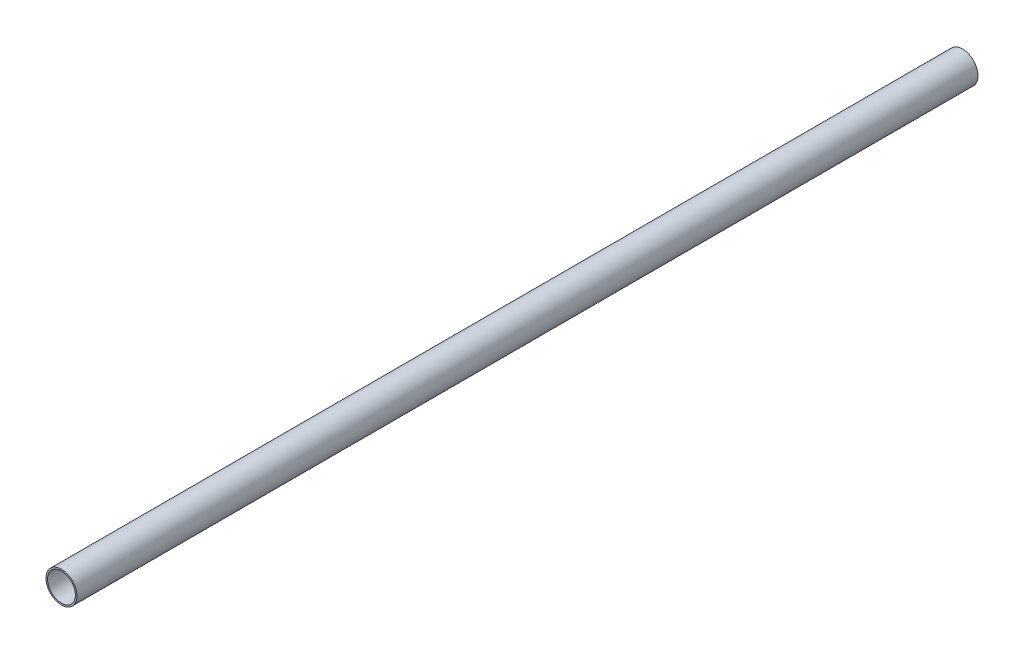
from build123d import *

# Parameters (mm, degrees)
SKETCH1_R = 5
SHELL1_T  = -0.5


with BuildPart() as part:
    # Sweep1: sweep along a path in Sketch2
    with BuildLine(Plane(origin=(0, 0, 0), x_dir=(1, 0, 0), z_dir=(0, 1, 0))) as sweep1_path:
        Line((0, 0), (0, 291))
    # Sketch1 → Sweep1 (sweep)
    with BuildSketch(Plane.XY):
        Circle(SKETCH1_R)
    sweep(path=sweep1_path.line)

    # Shell1
    shell1_openings = [part.faces().sort_by_distance(p)[0] for p in [
        (0, 0, -291),
        (0, 0, 0),
    ]]
    offset(amount=SHELL1_T, openings=shell1_openings, kind=Kind.INTERSECTION)


solid = part.part
